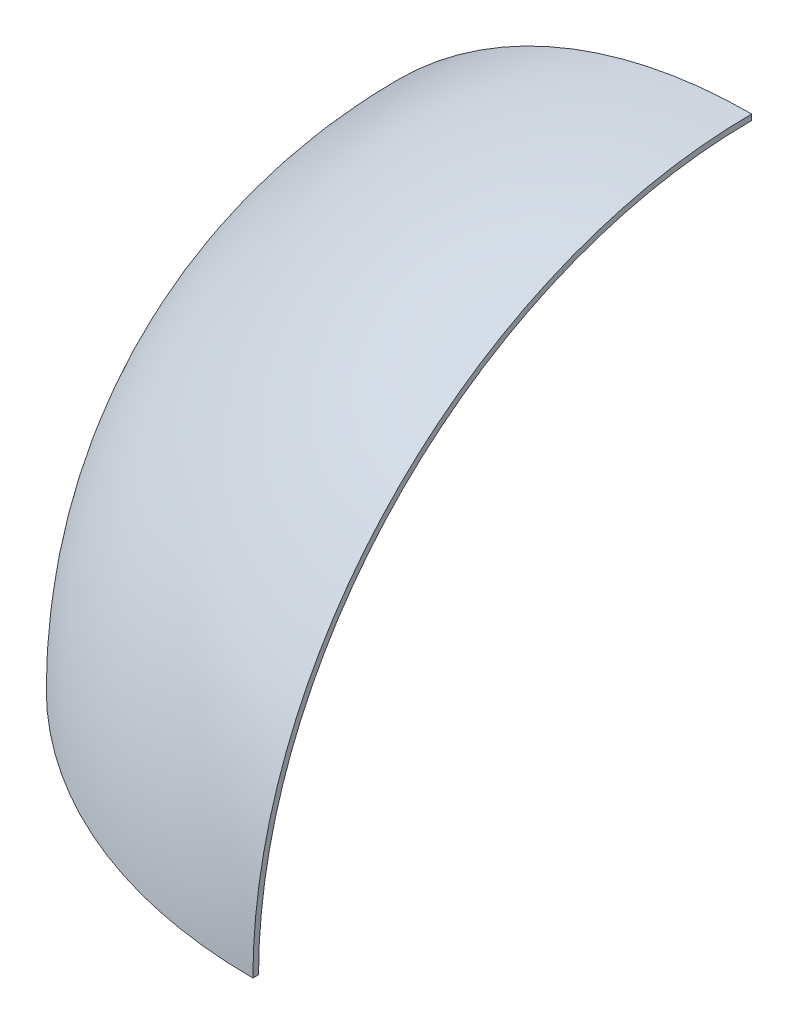
from build123d import *

# Parameters (mm, degrees)
REVOLVE1_ANGLE = 90


with BuildPart() as part:
    # Sketch1 → Revolve1 (revolve)
    with BuildSketch(Plane.XY):
        with BuildLine():
            Line((0, 87), (0, 88))
            ThreePointArc((0, 88), (-62.225396744, 62.225396744), (-88, 0))
            Line((-88, 0), (-87, 0))
            ThreePointArc((-87, 0), (-61.518289963, 61.518289963), (0, 87))
        make_face()
    revolve(axis=Axis((0, 0, 0), (0, 1, 0)), revolution_arc=REVOLVE1_ANGLE)


solid = part.part
